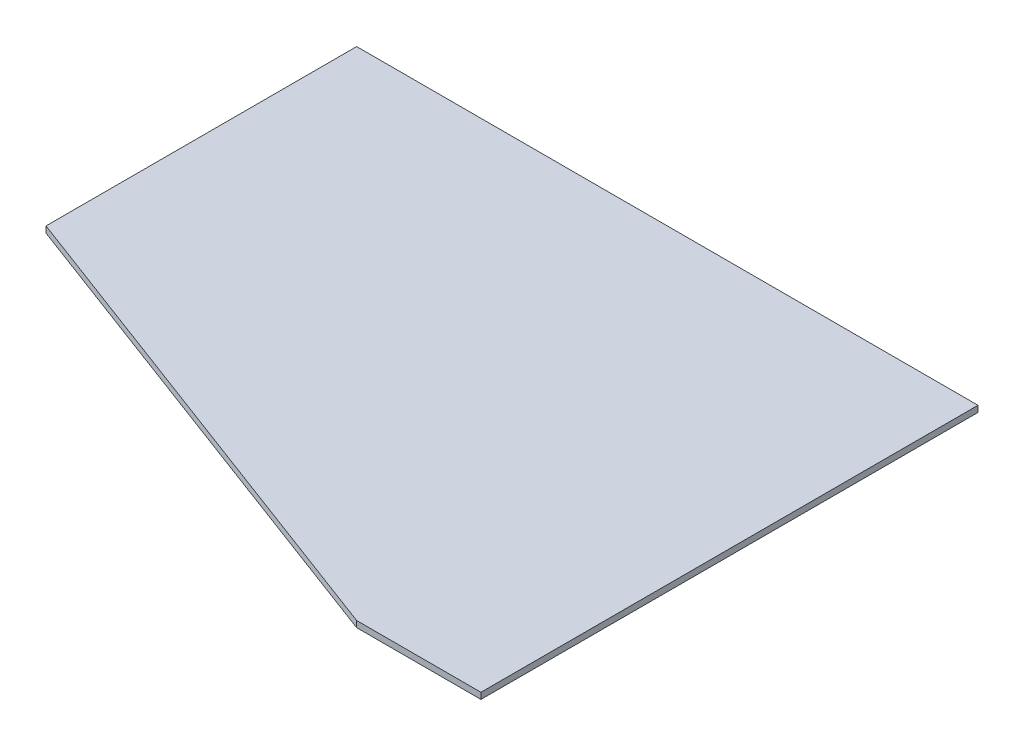
from build123d import *

# Parameters (mm, degrees)
EXTRUDE_1_DEPTH     = 10
SKETCH_2_R          = 40
CUT_EXTRUDE_1_DEPTH = 5


with BuildPart() as part:
    # Эскиз1 → Бобышка-Вытянуть1 (new body)
    with BuildSketch(Plane(origin=(0, 0, 0), x_dir=(1, 0, 0), z_dir=(0, 1, 0))):
        Polygon((1300, 0), (1500, 0), (1500, 800), (500, 800), (500, 300), align=None)
    extrude(amount=EXTRUDE_1_DEPTH)

    # Эскиз2 → Вырез-Вытянуть1 (cut)
    with BuildSketch(Plane.XZ):
        with Locations(Location((1400, -120, 0), (0, 0, 270))):
            Circle(SKETCH_2_R)
        with Locations(Location((1400, -700, 0), (0, 0, 270))):
            Circle(SKETCH_2_R)
    extrude(amount=-CUT_EXTRUDE_1_DEPTH, mode=Mode.SUBTRACT)


solid = part.part
